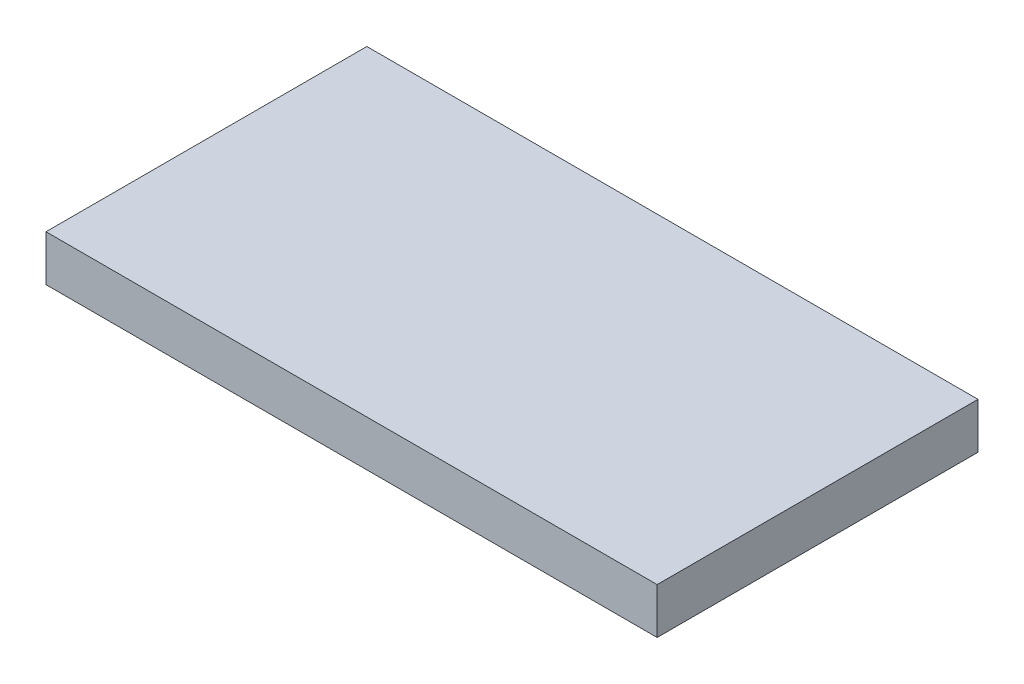
from build123d import *

# Parameters (mm, degrees)
BOSS_EXTRUDE1_DEPTH = 420


with BuildPart() as part:
    # Sketch2 → Boss-Extrude1 (new body)
    with BuildSketch(Plane.XY):
        Polygon((-137.293586306, -77.855725677), (662.706413694, -77.855725677), (662.706413694, -17.855725677), (412.706413694, -17.855725677), (362.706413694, -17.855725677), (312.706413694, -17.855725677), (62.706413694, -17.855725677), (12.706413694, -17.855725677), (-37.293586306, -17.855725677), (-137.293586306, -17.855725677), align=None)
    extrude(amount=BOSS_EXTRUDE1_DEPTH)


solid = part.part
